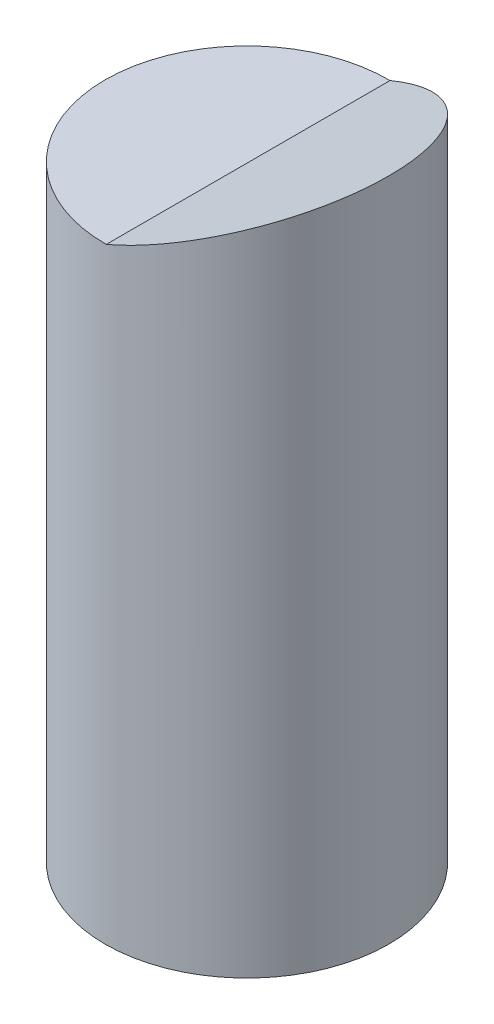
from build123d import *

# Parameters (mm, degrees)
SKETCH1_R                = 7.25
BOSS_EXTRUDE1_DEPTH      = 31
BOSS_EXTRUDE2_DEPTH      = 7.25
BOSS_EXTRUDE2_DEPTH_BACK = 7.25
CUT_EXTRUDE1_DEPTH       = 7.25
CUT_EXTRUDE1_DEPTH_BACK  = 7.25
SKETCH3_R                = 10.663559867
SKETCH3_R_2              = 7.25


with BuildPart() as part:
    # Sketch1 → Boss-Extrude1 (new body)
    with BuildSketch(Plane(origin=(0, 0, 0), x_dir=(1, 0, 0), z_dir=(0, 1, 0))):
        Circle(SKETCH1_R)
    extrude(amount=BOSS_EXTRUDE1_DEPTH)

    # Sketch2 → Boss-Extrude2 (add, two sides: drawn at the far end of the back side and taken through both)
    with BuildSketch(Plane.XY.offset(-BOSS_EXTRUDE2_DEPTH_BACK)):
        Polygon((0, 30.974625455), (7.25, 31), (7.25, 34), align=None)
    extrude(amount=BOSS_EXTRUDE2_DEPTH + BOSS_EXTRUDE2_DEPTH_BACK)

    # Sketch3 → Cut-Extrude1 (cut, two sides: drawn at the far end of the back side and taken through both)
    with BuildSketch(Plane(origin=(0, 31, 0), x_dir=(1, 0, 0), z_dir=(0, 1, 0)).offset(-CUT_EXTRUDE1_DEPTH_BACK)):
        Circle(SKETCH3_R)
        Circle(SKETCH3_R_2, mode=Mode.SUBTRACT)
    extrude(amount=CUT_EXTRUDE1_DEPTH + CUT_EXTRUDE1_DEPTH_BACK, mode=Mode.SUBTRACT)


solid = part.part
